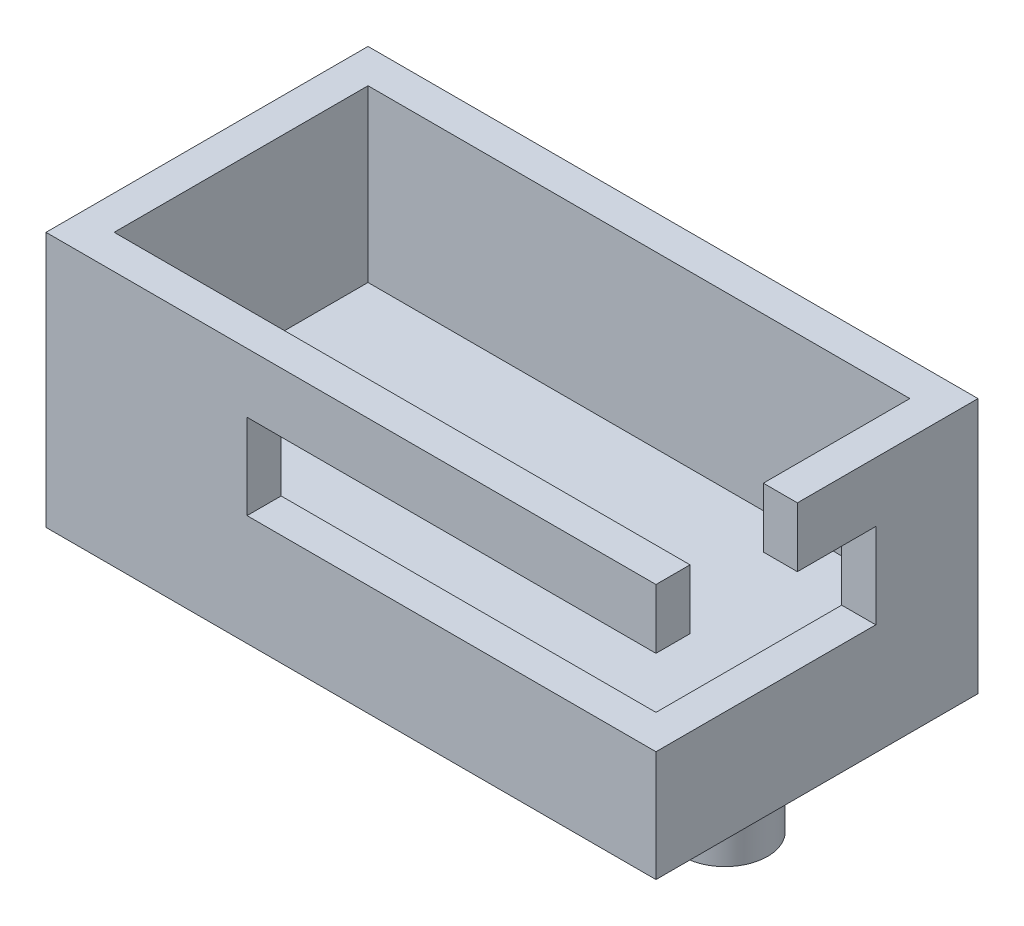
from build123d import *

# Parameters (mm, degrees)
SKETCH1_W           = 35.8
SKETCH1_H           = 18.9
SKETCH1_W_2         = 31.8
SKETCH1_H_2         = 14.9
BOSS_EXTRUDE1_DEPTH = 10
SKETCH1_2_W         = 35.8
SKETCH1_2_H         = 18.9
SKETCH1_2_W_2       = 31.8
SKETCH1_2_H_2       = 14.9
BOSS_EXTRUDE2_DEPTH = 5
SKETCH2_W           = 24
SKETCH2_H           = 5
CUT_EXTRUDE1_DEPTH  = 12.9
SKETCH3_W           = 6.3
SKETCH3_H           = 3.5
CUT_EXTRUDE2_DEPTH  = 2
SKETCH4_R           = 2.5
BOSS_EXTRUDE3_DEPTH = 5
FILLET1_R           = 0.4


with BuildPart() as part:
    # Sketch1 → Boss-Extrude1 (new body)
    with BuildSketch(Plane(origin=(0, 0, 0), x_dir=(1, 0, 0), z_dir=(0, 1, 0))):
        with Locations((15.9, 7.45)):
            Rectangle(SKETCH1_W, SKETCH1_H)
        with Locations((15.9, 7.45)):
            Rectangle(SKETCH1_W_2, SKETCH1_H_2, mode=Mode.SUBTRACT)
    extrude(amount=BOSS_EXTRUDE1_DEPTH)

    # Sketch1<2> → Boss-Extrude2 (add)
    # profile 1 of 2: a face of its own
    with BuildSketch(Plane(origin=(0, 0, 0), x_dir=(1, 0, 0), z_dir=(0, 1, 0))):
        with Locations((15.9, 7.45)):
            Rectangle(SKETCH1_2_W, SKETCH1_2_H)
        with Locations((15.9, 7.45)):
            Rectangle(SKETCH1_2_W_2, SKETCH1_2_H_2, mode=Mode.SUBTRACT)
    # profile 2 of 2: a face of its own
    with BuildSketch(Plane(origin=(0, 0, 0), x_dir=(1, 0, 0), z_dir=(0, 1, 0))):
        with Locations((15.9, 7.45)):
            Rectangle(SKETCH1_2_W_2, SKETCH1_2_H_2)
    extrude(amount=-BOSS_EXTRUDE2_DEPTH)

    # Sketch2 → Cut-Extrude1 (cut)
    with BuildSketch(Plane.XY.offset(2)):
        with Locations((21.8, 4)):
            Rectangle(SKETCH2_W, SKETCH2_H)
    extrude(amount=-CUT_EXTRUDE1_DEPTH, mode=Mode.SUBTRACT)

    # Sketch3 → Cut-Extrude2 (cut)
    with BuildSketch(Plane(origin=(33.8, 0, 0), x_dir=(0, 0, -1), z_dir=(1, 0, 0))):
        with Locations((3.15, 8.25)):
            Rectangle(SKETCH3_W, SKETCH3_H)
    extrude(amount=-CUT_EXTRUDE2_DEPTH, mode=Mode.SUBTRACT)

    # Sketch4 → Boss-Extrude3 (add)
    with BuildSketch(Plane.XZ.offset(5)):
        with Locations(Location((3.4, -7.45, 0), (0, 0, 90))):
            Circle(SKETCH4_R)
        with Locations(Location((28.4, -7.45, 0), (0, 0, 90))):
            Circle(SKETCH4_R)
    extrude(amount=BOSS_EXTRUDE3_DEPTH)

    # Fillet1
    fillet1_edges = [part.edges().sort_by_distance(p)[0] for p in [
        (3.4, -5, -9.95),
        (28.4, -5, -9.95),
    ]]
    fillet(fillet1_edges, radius=FILLET1_R)


solid = part.part
